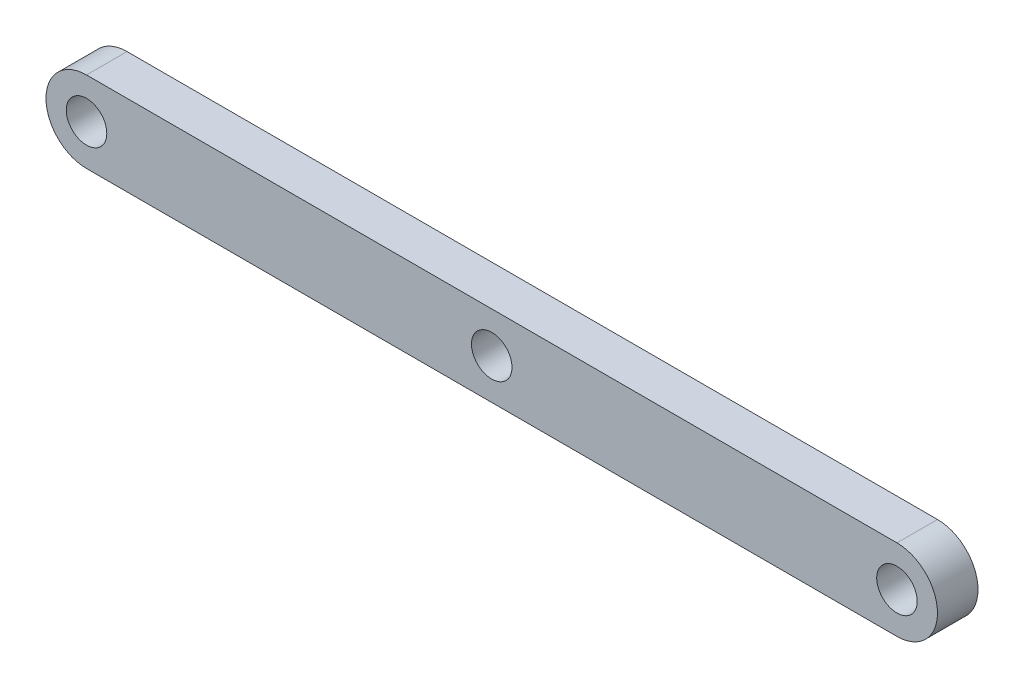
from build123d import *

# Parameters (mm, degrees)
SKETCH_1_R      = 1
EXTRUDE_1_DEPTH = 2


with BuildPart() as part:
    # 草圖1 → 填料-伸長1 (new body)
    with BuildSketch(Plane.XY):
        with BuildLine():
            Line((-19.999999973, 2.00103195), (20.000000027, 2.00103195))
            ThreePointArc((20.000000027, 2.00103195), (22.000000027, 0.00103195), (20.000000027, -1.99896805))
            Line((20.000000027, -1.99896805), (-19.999999973, -1.99896805))
            ThreePointArc((-19.999999973, -1.99896805), (-21.999999973, 0.00103195), (-19.999999973, 2.00103195))
        make_face()
        with Locations((-19.999999973, 0.00103195)):
            Circle(SKETCH_1_R, mode=Mode.SUBTRACT)
        with Locations((20.000000027, 0.00103195)):
            Circle(SKETCH_1_R, mode=Mode.SUBTRACT)
        Circle(SKETCH_1_R, mode=Mode.SUBTRACT)
    extrude(amount=EXTRUDE_1_DEPTH)


solid = part.part
